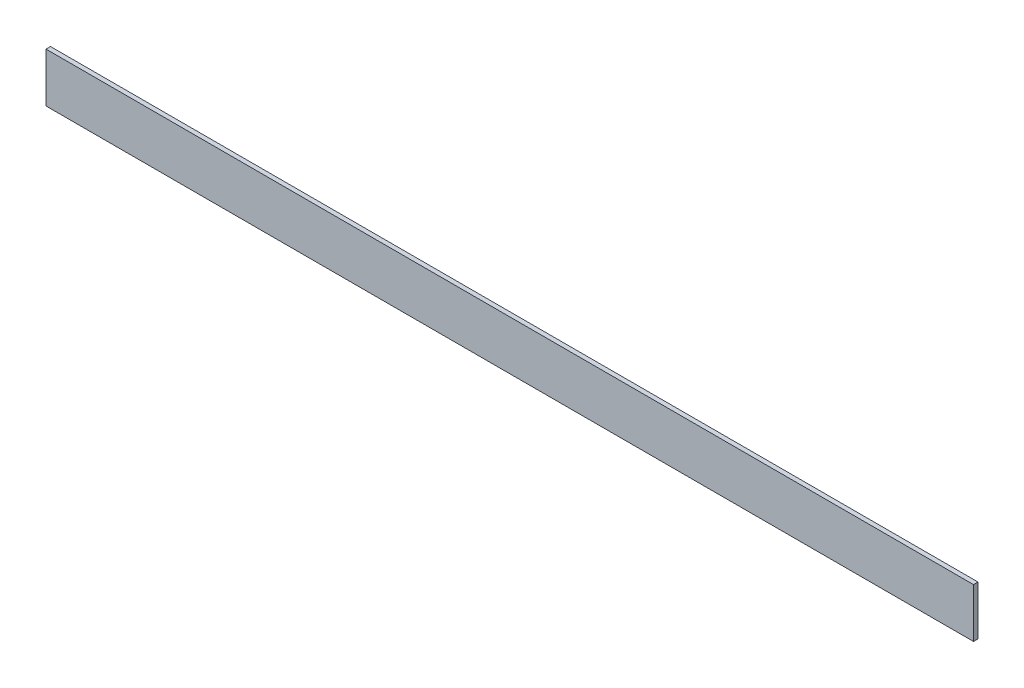
from build123d import *

# Parameters (mm, degrees)
TOP_RETURN_ABOVE_TREAD_PROFILE_W = 207
TOP_RETURN_ABOVE_TREAD_PROFILE_H = 11
TOP_RETURN_ABOVE_TREAD_DEPTH     = 1


with BuildPart() as part:
    # Top return above tread profile → Top return above tread (new body)
    with BuildSketch(Plane.XY):
        with Locations((-13.5, 0)):
            Rectangle(TOP_RETURN_ABOVE_TREAD_PROFILE_W, TOP_RETURN_ABOVE_TREAD_PROFILE_H)
    extrude(amount=TOP_RETURN_ABOVE_TREAD_DEPTH)


solid = part.part
